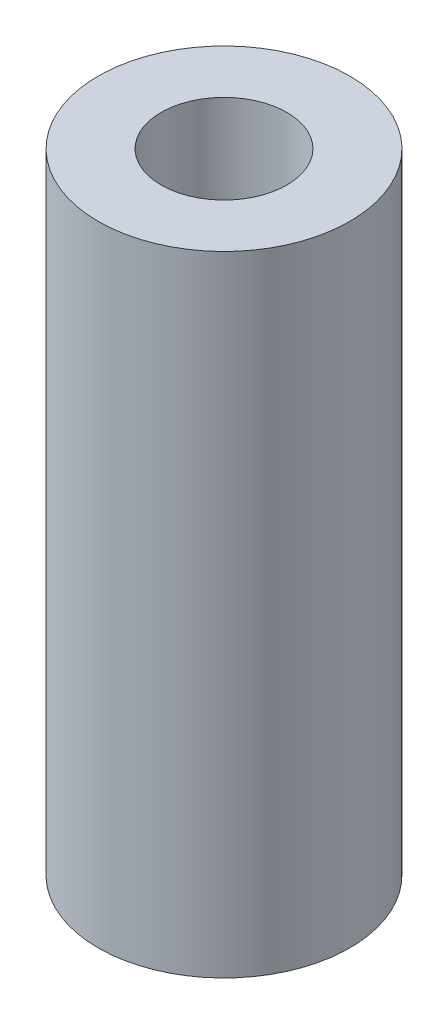
from build123d import *

# Parameters (mm, degrees)
SKETCH_1_R      = 3
SKETCH_1_R_2    = 1.55
EXTRUDE_1_DEPTH = 15
EXTRUDE_START   = -15
SKETCH_2_R      = 1.55
SKETCH_2_R_2    = 1.5
EXTRUDE_2_DEPTH = 15


with BuildPart() as part:
    # 草图1 → 凸台-拉伸1 (new body)
    with BuildSketch(Plane(origin=(0, 0, 0), x_dir=(1, 0, 0), z_dir=(0, 1, 0))):
        with Locations(Location((0, 0, 0), (0, 0, 270))):
            Circle(SKETCH_1_R)
        with Locations(Location((0, 0, 0), (0, 0, 270))):
            Circle(SKETCH_1_R_2, mode=Mode.SUBTRACT)
    extrude(amount=EXTRUDE_1_DEPTH)

    # 草图2 → 凸台-拉伸2 (add)
    with BuildSketch(Plane(origin=(0, 15, 0), x_dir=(1, 0, 0), z_dir=(0, 1, 0)).offset(EXTRUDE_START)):
        Circle(SKETCH_2_R)
        with Locations(Location((0, 0, 0), (0, 0, 270))):
            Circle(SKETCH_2_R_2, mode=Mode.SUBTRACT)
    extrude(amount=EXTRUDE_2_DEPTH)


solid = part.part
